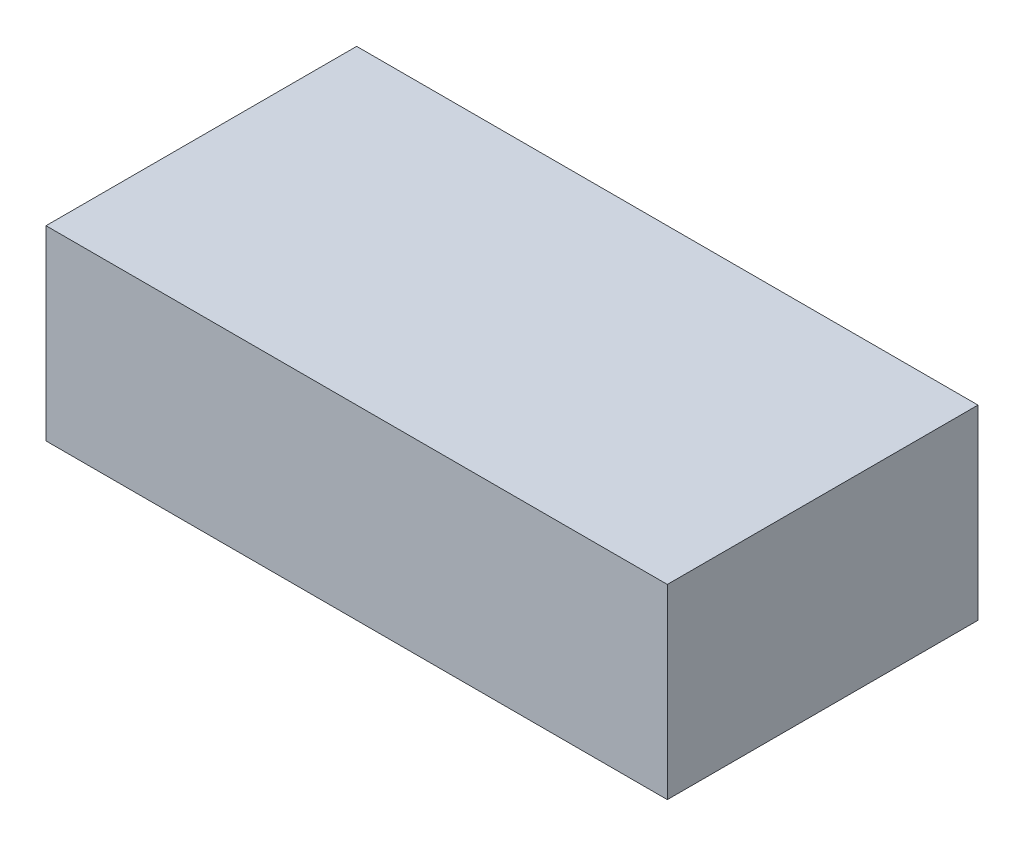
from build123d import *

# Parameters (mm, degrees)
SKETCH1_W           = 100
SKETCH1_H           = 50
BOSS_EXTRUDE1_DEPTH = 30


with BuildPart() as part:
    # Sketch1 → Boss-Extrude1 (new body)
    with BuildSketch(Plane(origin=(0, 0, 0), x_dir=(1, 0, 0), z_dir=(0, 1, 0))):
        with Locations((50, 25)):
            Rectangle(SKETCH1_W, SKETCH1_H)
    extrude(amount=BOSS_EXTRUDE1_DEPTH)


solid = part.part
